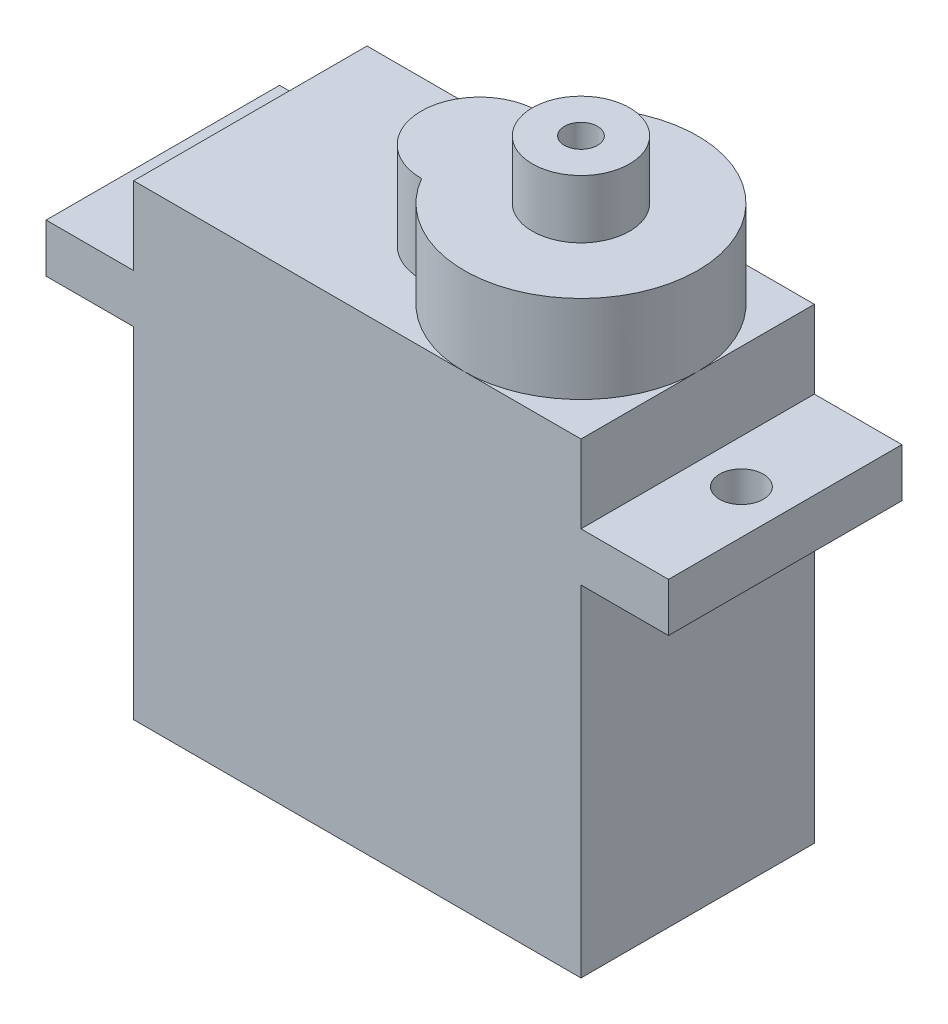
from build123d import *

# Parameters (mm, degrees)
SKETCH1_W           = 23
SKETCH1_H           = 12
BOSS_EXTRUDE1_DEPTH = 24
BOSS_EXTRUDE2_DEPTH = 4.5
SKETCH3_R           = 2.5
BOSS_EXTRUDE3_DEPTH = 3
SKETCH4_R           = 0.85
CUT_EXTRUDE1_DEPTH  = 5
BOSS_EXTRUDE4_START = -4
SKETCH5_W           = 4.5
SKETCH5_H           = 12
SKETCH5_R           = 1.125
BOSS_EXTRUDE4_DEPTH = 2.5


with BuildPart() as part:
    # Sketch1 → Boss-Extrude1 (new body)
    with BuildSketch(Plane(origin=(0, 0, 0), x_dir=(1, 0, 0), z_dir=(0, 1, 0))):
        Rectangle(SKETCH1_W, SKETCH1_H)
    extrude(amount=BOSS_EXTRUDE1_DEPTH)

    # Sketch2 → Boss-Extrude2 (add)
    with BuildSketch(Plane(origin=(0, 24, 0), x_dir=(1, 0, 0), z_dir=(0, 1, 0))):
        with BuildLine():
            ThreePointArc((0.303829175, 2.999968125), (-2.71, 0), (0.303829175, -2.999968125))
            ThreePointArc((0.303829175, -2.999968125), (11.5, 0), (0.303829175, 2.999968125))
        make_face()
    extrude(amount=BOSS_EXTRUDE2_DEPTH)

    # Sketch3 → Boss-Extrude3 (add)
    with BuildSketch(Plane(origin=(0, 28.5, 0), x_dir=(1, 0, 0), z_dir=(0, 1, 0))):
        with Locations(Location((5.5, 0, 0), (0, 0, 270))):
            Circle(SKETCH3_R)
    extrude(amount=BOSS_EXTRUDE3_DEPTH)

    # Sketch4 → Cut-Extrude1 (cut)
    with BuildSketch(Plane(origin=(0, 31.5, 0), x_dir=(1, 0, 0), z_dir=(0, 1, 0))):
        with Locations(Location((5.5, 0, 0), (0, 0, 270))):
            Circle(SKETCH4_R)
    extrude(amount=-CUT_EXTRUDE1_DEPTH, mode=Mode.SUBTRACT)

    # Sketch5 → Boss-Extrude4 (add)
    # profile 1 of 2: a face of its own
    with BuildSketch(Plane(origin=(0, 24, 0), x_dir=(1, 0, 0), z_dir=(0, 1, 0)).offset(BOSS_EXTRUDE4_START)):
        with Locations((-13.75, 0)):
            Rectangle(SKETCH5_W, SKETCH5_H)
        with Locations(Location((-13.75, 0, 0), (0, 0, 270))):
            Circle(SKETCH5_R, mode=Mode.SUBTRACT)
    # profile 2 of 2: a face of its own
    with BuildSketch(Plane(origin=(0, 24, 0), x_dir=(1, 0, 0), z_dir=(0, 1, 0)).offset(BOSS_EXTRUDE4_START)):
        with Locations((13.75, 0)):
            Rectangle(SKETCH5_W, SKETCH5_H)
        with Locations(Location((13.75, 0, 0), (0, 0, 90))):
            Circle(SKETCH5_R, mode=Mode.SUBTRACT)
    extrude(amount=-BOSS_EXTRUDE4_DEPTH)


solid = part.part
